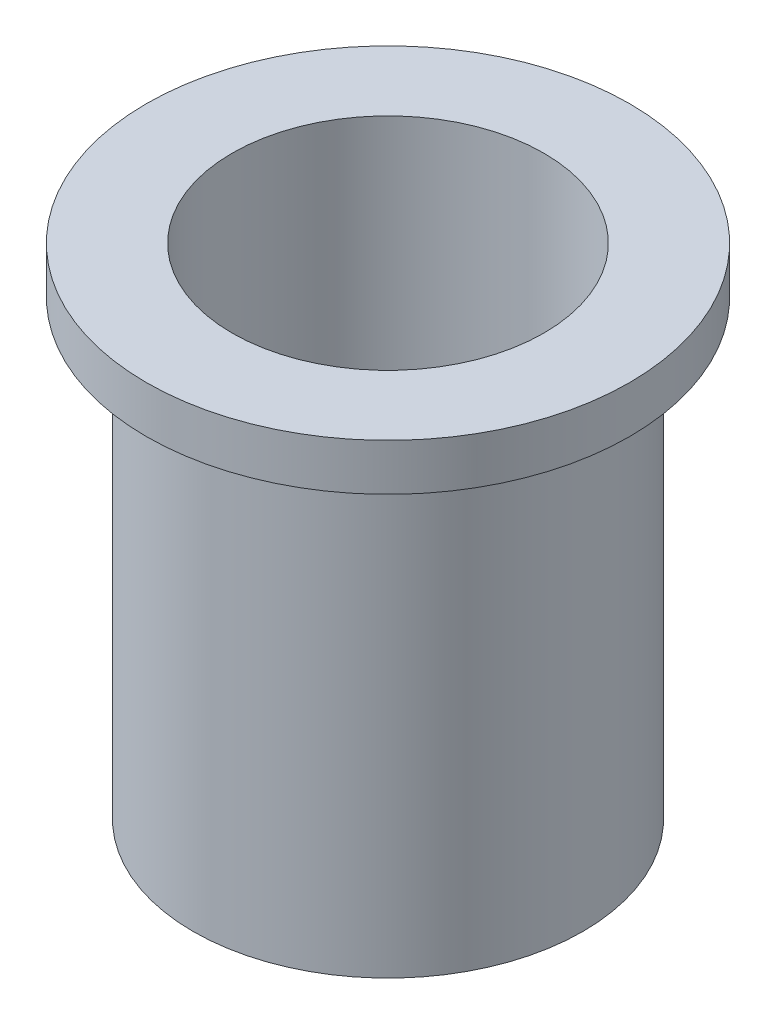
from build123d import *


with BuildPart() as part:
    # Sketch1 → Revolve1 (revolve)
    with BuildSketch(Plane.XY, mode=Mode.PRIVATE) as revolve1_sk:
        Polygon((20, 0), (20, 64), (31, 64), (31, 58), (25, 58), (25, 0), align=None)
    revolve(revolve1_sk.sketch.rotate(Axis((0, 0, 0), (0, 1, 0)), 90), axis=Axis((0, 0, 0), (0, 1, 0)))


solid = part.part
